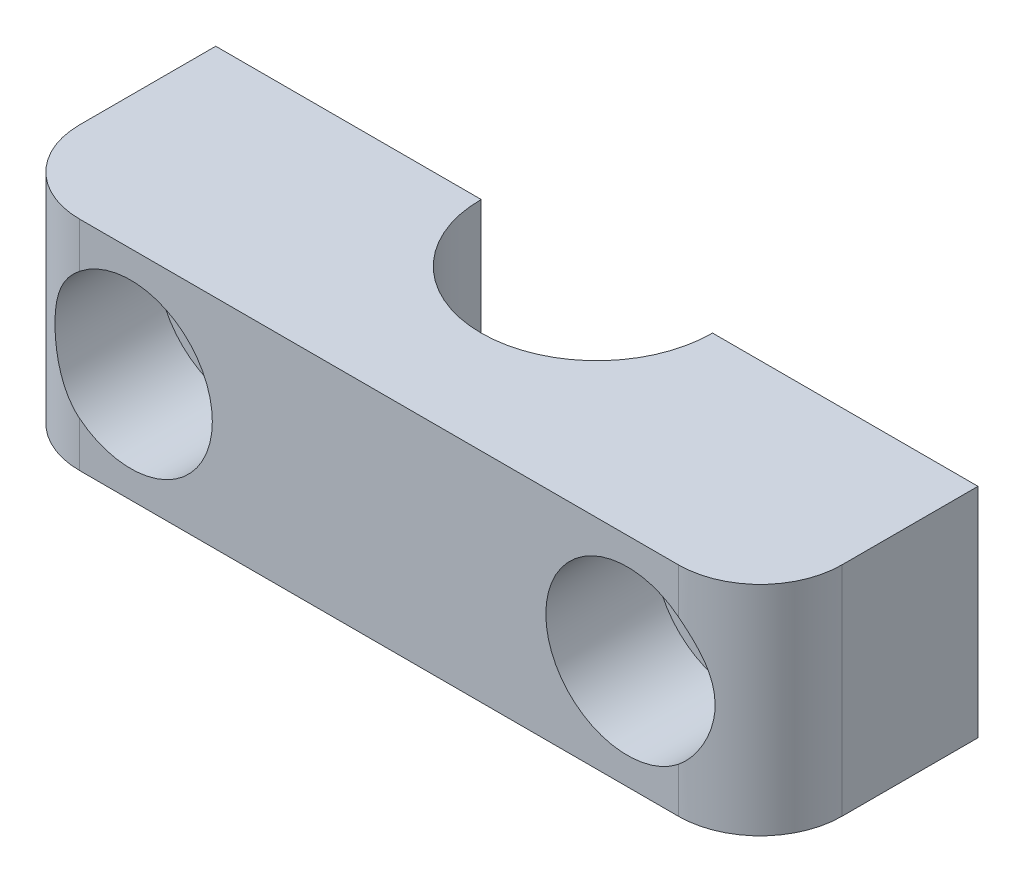
from build123d import *

# Parameters (mm, degrees)
SKETCH2_W                          = 28
SKETCH2_H                          = 8
BRIDGEBOSS_EXTRUDE2_DEPTH          = 8
GROMMETCUT_EXTRUDE3_DEPTH          = 31.199337741
BRIDGEMOUNTHOLESSKETCH4_R          = 1.55
BRIDGEMOUNTHOLESCUT_EXTRUDE4_DEPTH = 43.532340636
FILLET1_R                          = 3
SKETCH4_R                          = 3
MOUNTHOLESBORECUT_EXTRUDE1_DEPTH   = 4


with BuildPart() as part:
    # Sketch2 → BridgeBoss-Extrude2 (new body)
    with BuildSketch(Plane(origin=(0, 0, 0), x_dir=(1, 0, 0), z_dir=(0, 0, -1))):
        with Locations((14, 27)):
            Rectangle(SKETCH2_W, SKETCH2_H)
    extrude(amount=BRIDGEBOSS_EXTRUDE2_DEPTH)

    # Sketch3 → GrommetCut-Extrude3 (cut, through all)
    with BuildSketch(Plane(origin=(0, -23, 0), x_dir=(1, 0, 0), z_dir=(0, 1, 0))):
        with BuildLine():
            Line((9.75, 8), (18.25, 8))
            ThreePointArc((18.25, 8), (14, 3.75), (9.75, 8))
        make_face()
    extrude(amount=-GROMMETCUT_EXTRUDE3_DEPTH, mode=Mode.SUBTRACT)

    # BridgeMountHolesSketch4 → BridgeMountholesCut-Extrude4 (cut, through all)
    with BuildSketch(Plane(origin=(0, 0, -8), x_dir=(1, 0, 0), z_dir=(0, 0, -1))):
        with Locations(Location((4.875, 27, 0), (0, 0, 270))):
            Circle(BRIDGEMOUNTHOLESSKETCH4_R)
        with Locations(Location((23.125, 27, 0), (0, 0, 270))):
            Circle(BRIDGEMOUNTHOLESSKETCH4_R)
    extrude(amount=-BRIDGEMOUNTHOLESCUT_EXTRUDE4_DEPTH, mode=Mode.SUBTRACT)

    # Fillet1
    fillet1_edges = [part.edges().sort_by_distance(p)[0] for p in [
        (28, -27, 0),
        (0, -27, 0),
    ]]
    fillet(fillet1_edges, radius=FILLET1_R)

    # Sketch4 → MountHolesBoreCut-Extrude1 (cut)
    with BuildSketch(Plane.XY):
        with Locations((4.875, -27)):
            Circle(SKETCH4_R)
        with Locations((23.125, -27)):
            Circle(SKETCH4_R)
    extrude(amount=-MOUNTHOLESBORECUT_EXTRUDE1_DEPTH, mode=Mode.SUBTRACT)


solid = part.part
